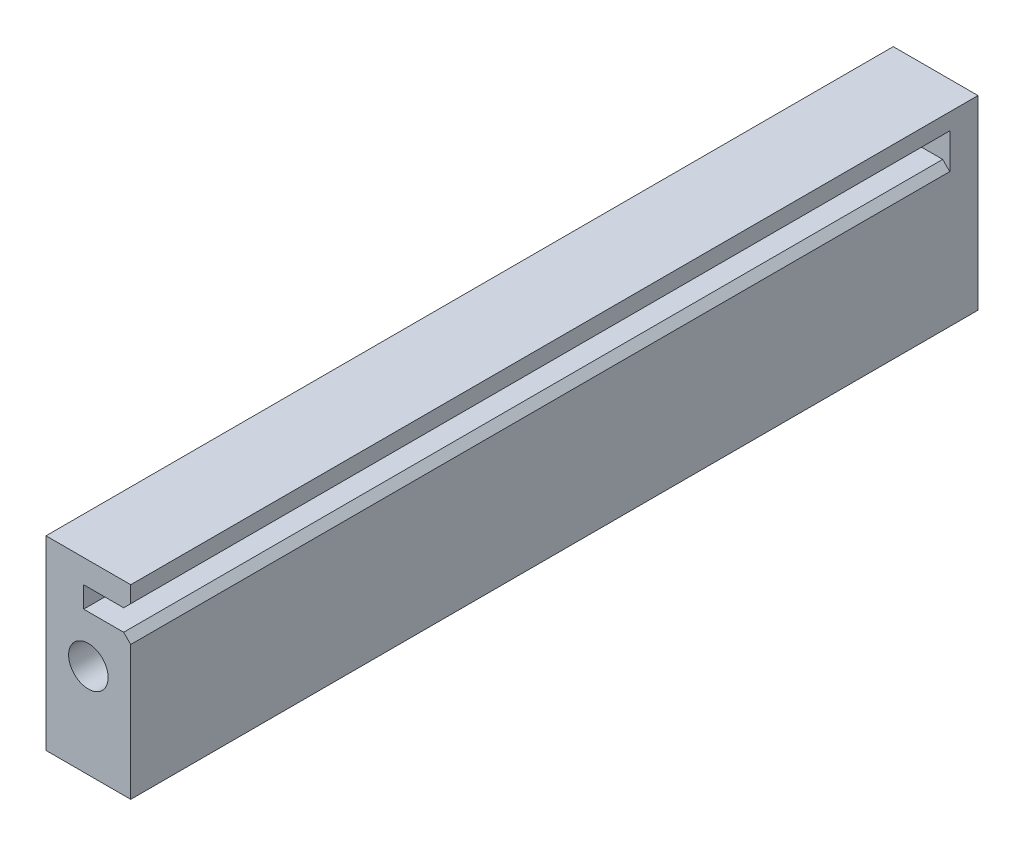
from build123d import *

# Parameters (mm, degrees)
SKETCH_1_W          = 9
SKETCH_1_H          = 15
EXTRUDE_1_DEPTH     = 90
SKETCH_2_R          = 2.1
CUT_EXTRUDE_1_DEPTH = 6
SKETCH_3_W          = 5
SKETCH_3_H          = 2.25
EXTRUDE_2_DEPTH     = 3
CHAMFER_1_SIZE      = 0.75
SKETCH_4_R          = 2.1
CUT_EXTRUDE_2_DEPTH = 6


with BuildPart() as part:
    # Эскиз1 → Бобышка-Вытянуть1 (new body)
    with BuildSketch(Plane.XY):
        Rectangle(SKETCH_1_W, SKETCH_1_H)
        Polygon((-4.5, 12.25), (-4.5, 7.5), (-0.5, 7.5), (-0.5, 9.75), (4.5, 9.75), (4.5, 12.25), align=None)
    extrude(amount=EXTRUDE_1_DEPTH)

    # Эскиз2 → Вырез-Вытянуть1 (cut)
    with BuildSketch(Plane.XZ.offset(7.5)):
        with Locations(Location((0, 22.5, 0), (0, 0, 270))):
            Circle(SKETCH_2_R)
        with Locations(Location((0, 67.5, 0), (0, 0, 270))):
            Circle(SKETCH_2_R)
        with Locations(Location((0, 45, 0), (0, 0, 270))):
            Circle(SKETCH_2_R)
    extrude(amount=-CUT_EXTRUDE_1_DEPTH, mode=Mode.SUBTRACT)

    # Эскиз3 → Бобышка-Вытянуть2 (add)
    with BuildSketch(Plane(origin=(0, 0, 0), x_dir=(-1, 0, 0), z_dir=(0, 0, -1))):
        with Locations((-2, 8.625)):
            Rectangle(SKETCH_3_W, SKETCH_3_H)
    extrude(amount=-EXTRUDE_2_DEPTH)

    # Фаска1
    chamfer_1_edges = [part.edges().sort_by_distance(p)[0] for p in [
        (4.5, 9.75, 46.5),
        (4.5, 7.5, 46.5),
    ]]
    chamfer(chamfer_1_edges, length=CHAMFER_1_SIZE)

    # Эскиз4 → Вырез-Вытянуть2 (cut)
    with BuildSketch(Plane.XY.offset(90)):
        with Locations((0, 2.5)):
            Circle(SKETCH_4_R)
    extrude(amount=-CUT_EXTRUDE_2_DEPTH, mode=Mode.SUBTRACT)


solid = part.part
